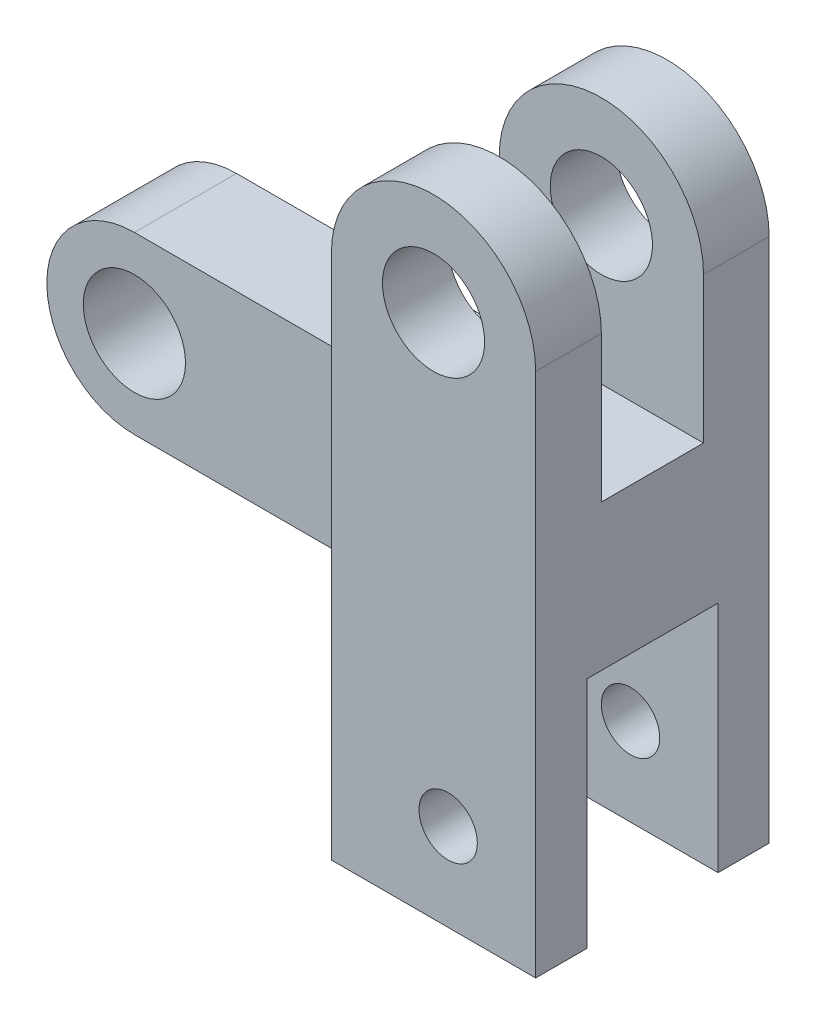
from build123d import *
from build123d.topology import SkipClean

# Parameters (mm, degrees)
SKETCH_1_W          = 7
SKETCH_1_H          = 7
EXTRUDE_1_DEPTH     = 2.4
EXTRUDE_6_DEPTH     = 1.75
EXTRUDE_START       = -5.25
EXTRUDE_8_DEPTH     = 1.75
SKETCH_11_R         = 1.75
CUT_EXTRUDE_1_DEPTH = 17.740669043
SKETCH_17_W         = 7
SKETCH_17_H         = 7
EXTRUDE_10_DEPTH    = 8
SKETCH_15_R         = 1.75
EXTRUDE_9_DEPTH     = 1.75
SKETCH_12_R         = 1
CUT_EXTRUDE_2_DEPTH = 19.357559751
SKETCH_18_W         = 7
SKETCH_18_H         = 4.5
CUT_EXTRUDE_4_DEPTH = 8
SKETCH_19_R         = 1
SKETCH_19_R_2       = 1.75
EXTRUDE_11_DEPTH    = 0.5
EXTRUDE_START_2     = 0.5
SKETCH_20_R         = 1
SKETCH_20_R_2       = 1.75
EXTRUDE_12_DEPTH    = 0.5


with BuildPart() as part:
    # 草图1 → 凸台-拉伸1 (new body)
    with BuildSketch(Plane(origin=(0, 0, 0), x_dir=(1, 0, 0), z_dir=(0, 1, 0))):
        with Locations((3.5, 0)):
            Rectangle(SKETCH_1_W, SKETCH_1_H)
    extrude(amount=EXTRUDE_1_DEPTH)

    # 草图10 → 凸台-拉伸6 (add)
    with BuildSketch(Plane(origin=(0, 0, -3.5), x_dir=(-1, 0, 0), z_dir=(0, 0, -1))):
        with BuildLine():
            Line((-7, 10), (-7, 2.4))
            Line((-7, 2.4), (0, 2.4))
            Line((0, 2.4), (0, 10))
            ThreePointArc((0, 10), (-3.5, 13.5), (-7, 10))
        make_face()
    extrude(amount=-EXTRUDE_6_DEPTH)

    # 草图10<2> → 凸台-拉伸8 (add)
    with BuildSketch(Plane(origin=(0, 0, -3.5), x_dir=(-1, 0, 0), z_dir=(0, 0, -1)).offset(EXTRUDE_START)):
        with BuildLine():
            Line((-7, 10), (-7, 2.4))
            Line((-7, 2.4), (0, 2.4))
            Line((0, 2.4), (0, 10))
            ThreePointArc((0, 10), (-3.5, 13.5), (-7, 10))
        make_face()
    extrude(amount=-EXTRUDE_8_DEPTH)

    # 草图11 → 切除-拉伸1 (cut, through all)
    with BuildSketch(Plane(origin=(0, 0, -3.5), x_dir=(-1, 0, 0), z_dir=(0, 0, -1))):
        with Locations((-3.5, 10)):
            Circle(SKETCH_11_R)
    extrude(amount=-CUT_EXTRUDE_1_DEPTH, mode=Mode.SUBTRACT)

    # 草图17 → 凸台-拉伸10 (add)
    with BuildSketch(Plane.XZ):
        with Locations((3.5, 0)):
            Rectangle(SKETCH_17_W, SKETCH_17_H)
    extrude(amount=EXTRUDE_10_DEPTH)

    # 草图15 → 凸台-拉伸9 (add, symmetric)
    with BuildSketch(Plane.XY):
        with BuildLine():
            Line((7, 2.4), (7, 5))
            Line((7, 5), (-9, 5))
            ThreePointArc((-9, 5), (-12, 2), (-9, -1))
            Line((-9, -1), (7, -1))
            Line((7, -1), (7, 2.4))
        make_face()
        with Locations((-9, 2)):
            Circle(SKETCH_15_R, mode=Mode.SUBTRACT)
    extrude(amount=EXTRUDE_9_DEPTH, both=True)

    # 草图12 → 切除-拉伸2 (cut, through all)
    with BuildSketch(Plane(origin=(0, 4, 3.5), x_dir=(1, 0, 0), z_dir=(0, 0, -1))):
        with Locations((4, 9)):
            Circle(SKETCH_12_R)
    extrude(amount=CUT_EXTRUDE_2_DEPTH, mode=Mode.SUBTRACT)

    # 草图18 → 切除-拉伸4 (cut)
    with BuildSketch(Plane(origin=(7.4, -8, 0), x_dir=(1, 0, 0), z_dir=(0, 1, 0))):
        with Locations((-3.9, 0)):
            Rectangle(SKETCH_18_W, SKETCH_18_H)
    extrude(amount=CUT_EXTRUDE_4_DEPTH, mode=Mode.SUBTRACT)

    # 草图19 → 凸台-拉伸11 (add)
    with SkipClean():  # the faces are left unmerged after this step: merging them gives an invalid solid
        with BuildSketch(Plane.XY.offset(3.5)):
            with BuildLine():
                Line((0, 10), (0, -8))
                Line((0, -8), (7, -8))
                Line((7, -8), (7, 10))
                ThreePointArc((7, 10), (3.5, 13.5), (0, 10))
            make_face()
            with Locations((4, -5)):
                Circle(SKETCH_19_R, mode=Mode.SUBTRACT)
            with Locations((3.5, 10)):
                Circle(SKETCH_19_R_2, mode=Mode.SUBTRACT)
        extrude(amount=EXTRUDE_11_DEPTH)

    # 草图20 → 凸台-拉伸12 (add)
    with SkipClean():  # the faces are left unmerged after this step: merging them gives an invalid solid
        with BuildSketch(Plane(origin=(0, 0, -3.5), x_dir=(-1, 0, 0), z_dir=(0, 0, -1)).offset(EXTRUDE_START_2)):
            with BuildLine():
                Line((-7, 10), (-7, -8))
                Line((-7, -8), (0, -8))
                Line((0, -8), (0, 10))
                ThreePointArc((0, 10), (-3.5, 13.5), (-7, 10))
            make_face()
            with Locations((-4, -5)):
                Circle(SKETCH_20_R, mode=Mode.SUBTRACT)
            with Locations((-3.5, 10)):
                Circle(SKETCH_20_R_2, mode=Mode.SUBTRACT)
        extrude(amount=-EXTRUDE_12_DEPTH)


solid = part.part
